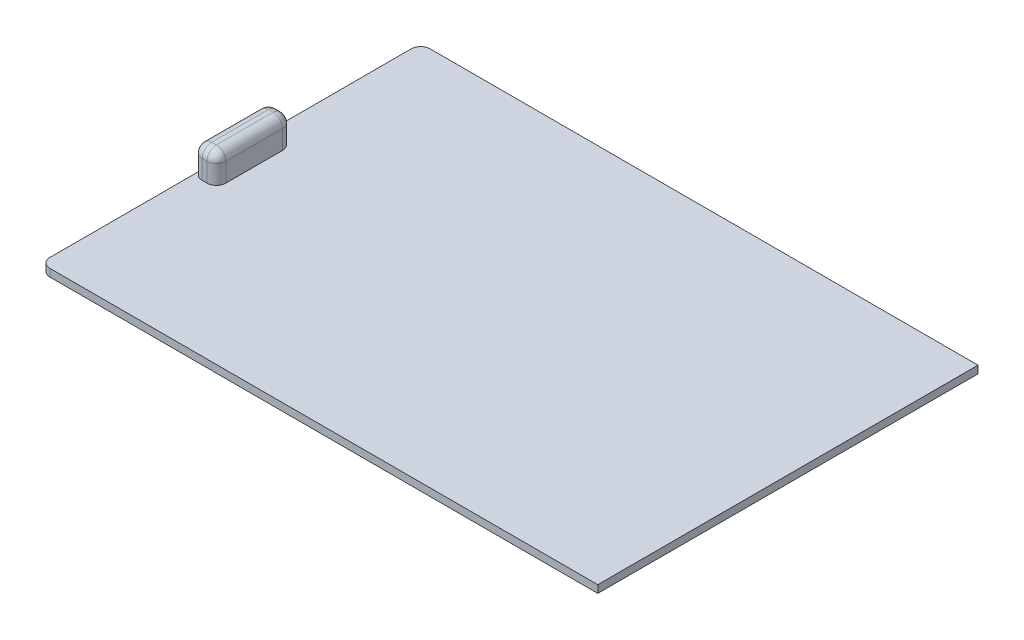
from build123d import *

# Parameters (mm, degrees)
SKETCH1_W           = 118
SKETCH1_H           = 80.5
LID_EXTRUDE_DEPTH   = 1.6
LID_EDGE_FILLET_R   = 2
SKETCH2_W           = 5
SKETCH2_H           = 16
BOSS_EXTRUDE2_DEPTH = 6
FILLET2_R           = 2


with BuildPart() as part:
    # Sketch1 → lid extrude (new body)
    with BuildSketch(Plane(origin=(0, 0, 0), x_dir=(1, 0, 0), z_dir=(0, 1, 0))):
        with Locations((59, -40.25)):
            Rectangle(SKETCH1_W, SKETCH1_H)
    extrude(amount=LID_EXTRUDE_DEPTH)

    # lid edge fillet
    lid_edge_fillet_edges = [part.edges().sort_by_distance(p)[0] for p in [
        (0, 0.8, 0),
        (0, 0.8, 80.5),
    ]]
    fillet(lid_edge_fillet_edges, radius=LID_EDGE_FILLET_R)

    # Sketch2 → Boss-Extrude2 (add)
    with BuildSketch(Plane(origin=(0, 1.6, 0), x_dir=(1, 0, 0), z_dir=(0, 1, 0))):
        with Locations((2.5, -40.25)):
            Rectangle(SKETCH2_W, SKETCH2_H)
    extrude(amount=BOSS_EXTRUDE2_DEPTH)

    # Fillet2
    fillet2_edges = [part.edges().sort_by_distance(p)[0] for p in [
        (0, 4.6, 32.25),
        (2.5, 7.6, 48.25),
        (0, 4.6, 48.25),
        (5, 7.6, 40.25),
        (5, 4.6, 48.25),
        (2.5, 7.6, 32.25),
        (5, 4.6, 32.25),
        (0, 7.6, 40.25),
    ]]
    fillet(fillet2_edges, radius=FILLET2_R)


solid = part.part
